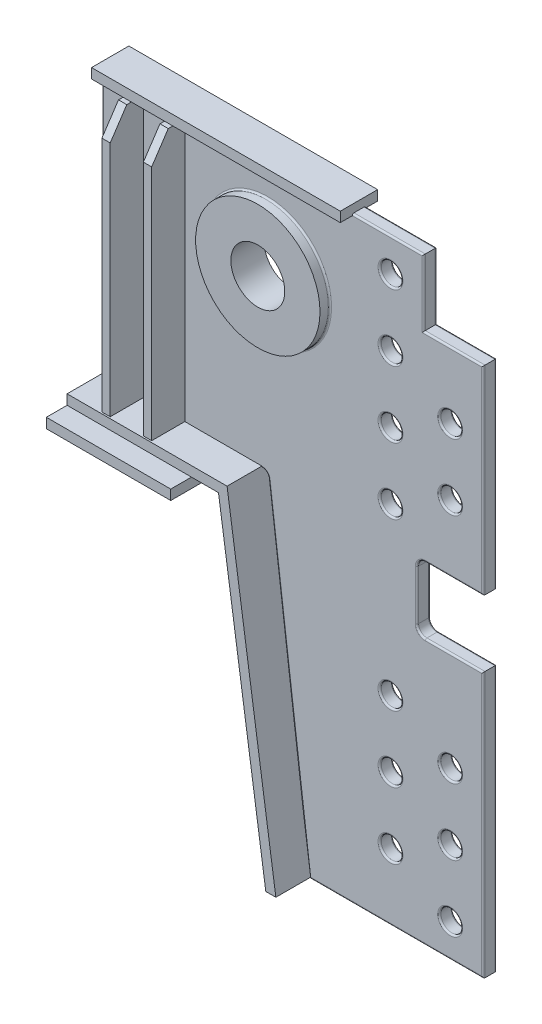
from build123d import *

# Parameters (mm, degrees)
SKETCH_1_R           = 13
SKETCH_1_R_2         = 37.5
EXTRUDE_1314_DEPTH   = 16
EXTRUDE_1_DEPTH      = 12
EXTRUDE_1_DEPTH_BACK = 28
SKETCH_2_R           = 75
SKETCH_2_R_2         = 32.5
FILLET_1_R           = 2
FILLET_2_R           = 2
EXTRUDE_2_DEPTH      = 40
EXTRUDE_2_DEPTH_BACK = 56
SKETCH_3_W           = 10
SKETCH_3_H           = 316
CUT_EXTRUDE_1_DEPTH  = 836.425640018
CUT_EXTRUDE_2_DEPTH  = 836.425640018
EXTRUDE_5_DEPTH      = 42
EXTRUDE_5_DEPTH_BACK = 58
EXTRUDE_6_DEPTH      = 14.5
EXTRUDE_6_DEPTH_BACK = 30.5
SKETCH_7_W           = 300
SKETCH_7_H           = 12
SKETCH_8_W           = 150
SKETCH_8_H           = 150
EXTRUDE_7_DEPTH      = 12


with BuildPart() as part:
    # 草图1 → Extrude 1314 (new body)
    with BuildSketch(Plane.XY):
        with BuildLine():
            Line((0, -320), (-70, -320))
            ThreePointArc((-70, -320), (-77.071067812, -322.928932188), (-80, -330))
            Line((-80, -330), (-80, -390))
            ThreePointArc((-80, -390), (-77.071067812, -397.071067812), (-70, -400))
            Line((-70, -400), (0, -400))
            Line((0, -400), (0, -720))
            Line((0, -720), (-210, -720))
            Line((-210, -720), (-259.124034735, -327.007722123))
            ThreePointArc((-259.124034735, -327.007722123), (-261.767837242, -322.002574593), (-267.062257748, -320))
            Line((-267.062257748, -320), (-460, -320))
            Line((-460, -320), (-460, 0))
            Line((-460, 0), (-72, 0))
            Line((-72, 0), (-72, -80))
            Line((-72, -80), (0, -80))
            Line((0, -80), (0, -320))
        make_face()
        with Locations((-112, -40)):
            Circle(SKETCH_1_R, mode=Mode.SUBTRACT)
        with Locations((-112, -120)):
            Circle(SKETCH_1_R, mode=Mode.SUBTRACT)
        with Locations((-112, -200)):
            Circle(SKETCH_1_R, mode=Mode.SUBTRACT)
        with Locations((-112, -280)):
            Circle(SKETCH_1_R, mode=Mode.SUBTRACT)
        with Locations((-40, -160)):
            Circle(SKETCH_1_R, mode=Mode.SUBTRACT)
        with Locations((-40, -240)):
            Circle(SKETCH_1_R, mode=Mode.SUBTRACT)
        with Locations((-40, -680)):
            Circle(SKETCH_1_R, mode=Mode.SUBTRACT)
        with Locations((-40, -600)):
            Circle(SKETCH_1_R, mode=Mode.SUBTRACT)
        with Locations((-40, -520)):
            Circle(SKETCH_1_R, mode=Mode.SUBTRACT)
        with Locations((-112, -640)):
            Circle(SKETCH_1_R, mode=Mode.SUBTRACT)
        with Locations((-112, -560)):
            Circle(SKETCH_1_R, mode=Mode.SUBTRACT)
        with Locations((-112, -480)):
            Circle(SKETCH_1_R, mode=Mode.SUBTRACT)
        with Locations((-260, -110)):
            Circle(SKETCH_1_R_2, mode=Mode.SUBTRACT)
    extrude(amount=EXTRUDE_1314_DEPTH)

    # 草图2 → 凸台-拉伸1 (add, two sides: drawn at the far end of the back side and taken through both)
    with BuildSketch(Plane.XY.offset(16).offset(-EXTRUDE_1_DEPTH_BACK)):
        with Locations((-260, -110)):
            Circle(SKETCH_2_R)
        with Locations((-260, -110)):
            Circle(SKETCH_2_R_2, mode=Mode.SUBTRACT)
    extrude(amount=EXTRUDE_1_DEPTH + EXTRUDE_1_DEPTH_BACK)

    # 圆角1
    fillet_1_edges = [part.edges().sort_by_distance(p)[0] for p in [
        (-105, -720, 16),
        (0, -560, 16),
        (-35, -400, 16),
        (-77.071067812, -397.071067812, 16),
        (-80, -360, 16),
        (-77.071067812, -322.928932188, 16),
        (-35, -320, 16),
        (0, -200, 16),
        (-36, -80, 16),
        (-125, -40, 16),
        (-72, -40, 16),
        (-261.767837242, -322.002574593, 16),
        (-266, 0, 16),
        (-125, -120, 16),
        (-460, -160, 16),
        (-125, -200, 16),
        (-363.531128874, -320, 16),
        (-125, -280, 16),
        (-53, -160, 16),
        (-53, -240, 16),
        (-53, -680, 16),
        (-53, -600, 16),
        (-53, -520, 16),
        (-234.562017367, -523.503861062, 16),
        (-125, -640, 16),
        (-125, -560, 16),
        (-125, -480, 16),
        (-335, -110, 16),
    ]]
    fillet(fillet_1_edges, radius=FILLET_1_R)

    # 圆角2
    fillet_2_edges = [part.edges().sort_by_distance(p)[0] for p in [
        (-363.531128874, -320, 0),
        (-460, -160, 0),
        (-266, 0, 0),
        (-72, -40, 0),
        (-36, -80, 0),
        (0, -200, 0),
        (-35, -320, 0),
        (-77.071067812, -322.928932188, 0),
        (-80, -360, 0),
        (-77.071067812, -397.071067812, 0),
        (-35, -400, 0),
        (0, -560, 0),
        (-105, -720, 0),
        (-234.562017367, -523.503861062, 0),
        (-261.767837242, -322.002574593, 0),
        (-125, -40, 0),
        (-125, -120, 0),
        (-125, -200, 0),
        (-125, -280, 0),
        (-53, -160, 0),
        (-53, -240, 0),
        (-53, -680, 0),
        (-53, -600, 0),
        (-53, -520, 0),
        (-125, -640, 0),
        (-125, -560, 0),
        (-125, -480, 0),
        (-335, -110, 0),
    ]]
    fillet(fillet_2_edges, radius=FILLET_2_R)

    # 草图3 → 凸台-拉伸2 (add, two sides: drawn at the far end of the back side and taken through both)
    with BuildSketch(Plane.XY.offset(16).offset(-EXTRUDE_2_DEPTH_BACK)):
        with Locations((-415, -160)):
            Rectangle(SKETCH_3_W, SKETCH_3_H)
        with Locations((-365, -160)):
            Rectangle(SKETCH_3_W, SKETCH_3_H)
    extrude(amount=EXTRUDE_2_DEPTH + EXTRUDE_2_DEPTH_BACK)

    # 草图4 → 切除-拉伸1 (cut, through all)
    with BuildSketch(Plane.ZY.offset(420)):
        Polygon((-20, -2), (-45.5, -32), (-45.5, -2), align=None)
    extrude(amount=-CUT_EXTRUDE_1_DEPTH, mode=Mode.SUBTRACT)

    # 草图5 → 切除-拉伸2 (cut, through all)
    with BuildSketch(Plane.ZY.offset(420)):
        Polygon((36, -2), (56, -32), (56, -2), align=None)
    extrude(amount=-CUT_EXTRUDE_2_DEPTH, mode=Mode.SUBTRACT)

    # 草图6 → 凸台-拉伸5 (add, two sides: drawn at the far end of the back side and taken through both)
    with BuildSketch(Plane.XY.offset(16).offset(-EXTRUDE_5_DEPTH_BACK)):
        Polygon((-267.062257748, -318), (-460, -318), (-460, -330), (-277.426505546, -330), (-220.363518026, -718), (-208.234435563, -718), align=None)
    extrude(amount=EXTRUDE_5_DEPTH + EXTRUDE_5_DEPTH_BACK)

    # 草图7 → 凸台-拉伸6 (add, two sides: drawn at the far end of the back side and taken through both)
    with BuildSketch(Plane(origin=(0, 0, 0), x_dir=(-1, 0, 0), z_dir=(0, 0, -1)).offset(-EXTRUDE_6_DEPTH_BACK)):
        with Locations((308, 4)):
            Rectangle(SKETCH_7_W, SKETCH_7_H)
    extrude(amount=EXTRUDE_6_DEPTH + EXTRUDE_6_DEPTH_BACK)

    # 草图8 → 凸台-拉伸7 (add)
    with BuildSketch(Plane.XZ.offset(330)):
        with Locations((-385, 8)):
            Rectangle(SKETCH_8_W, SKETCH_8_H)
    extrude(amount=EXTRUDE_7_DEPTH)


solid = part.part
